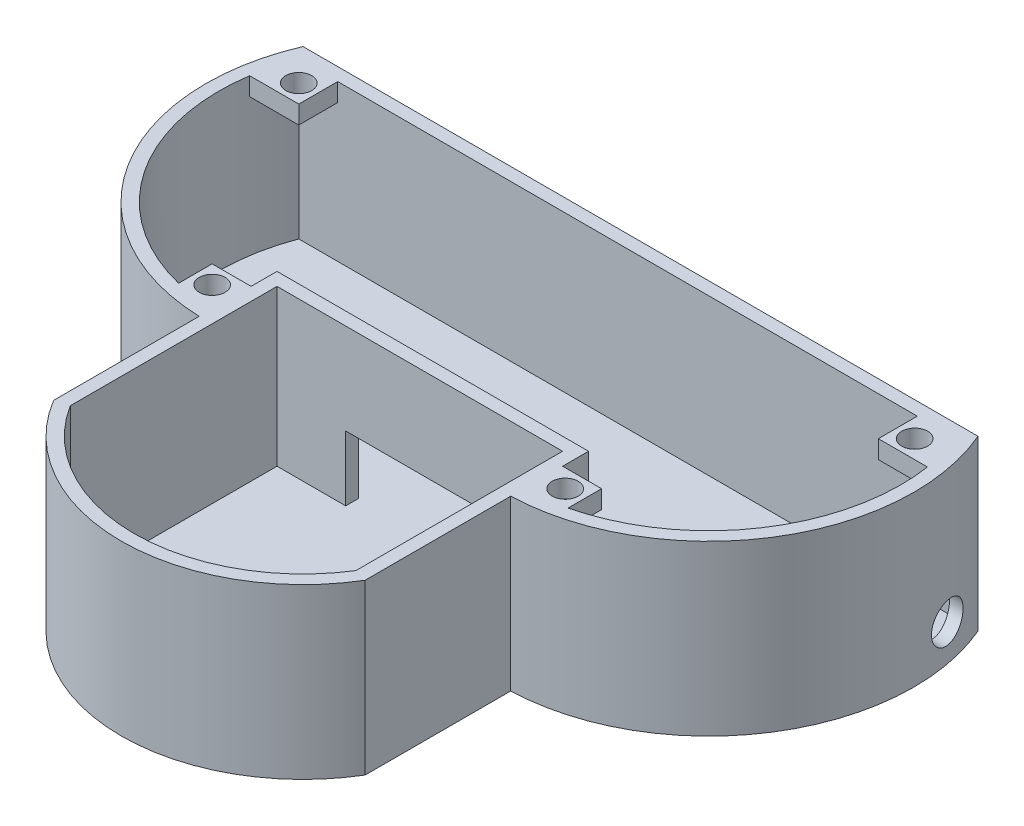
from build123d import *

# Parameters (mm, degrees)
SALIENTE_EXTRUIR1_DEPTH    = 65
VACIADO1_T                 = -5
SALIENTE_EXTRUIR2_DEPTH    = 60
CROQUIS4_W                 = 60.454390592
CROQUIS4_H                 = 25
CORTAR_EXTRUIR1_DEPTH      = 65
CORTAR_EXTRUIR2_DEPTH      = 65
CORTAR_EXTRUIR2_DEPTH_BACK = 75
CROQUIS5_R                 = 7.5
SALIENTE_EXTRUIR3_START    = -7
SALIENTE_EXTRUIR3_DEPTH    = 7
SALIENTE_EXTRUIR5_START    = -7
SALIENTE_EXTRUIR5_DEPTH    = 7
SALIENTE_EXTRUIR7_START    = -7
SALIENTE_EXTRUIR7_DEPTH    = 7
SALIENTE_EXTRUIR8_START    = -7
SALIENTE_EXTRUIR8_DEPTH    = 7
CROQUIS12_R                = 5
CORTAR_EXTRUIR3_DEPTH      = 8


with BuildPart() as part:
    # Croquis2 → Saliente-Extruir1 (new body)
    with BuildSketch(Plane(origin=(0, 0, 0), x_dir=(1, 0, 0), z_dir=(0, 1, 0))):
        with BuildLine():
            ThreePointArc((60, -55), (124.004556318, -18.45744493), (130, 55))
            Line((130, 55), (-130, 55))
            ThreePointArc((-130, 55), (-124.004556318, -18.45744493), (-60, -55))
            Line((-60, -55), (-60, -111.06))
            ThreePointArc((-60, -111.06), (0, -145.004487245), (60, -111.06))
            Line((60, -111.06), (60, -55))
        make_face()
    extrude(amount=SALIENTE_EXTRUIR1_DEPTH)

    # Vaciado1
    vaciado1_openings = [part.faces().sort_by_distance(p)[0] for p in [
        (0, 65, 22.416037692),
    ]]
    offset(amount=VACIADO1_T, openings=vaciado1_openings, kind=Kind.INTERSECTION)

    # Croquis3 → Saliente-Extruir2 (add)
    with BuildSketch(Plane(origin=(0, 5, 0), x_dir=(1, 0, 0), z_dir=(0, 1, 0))):
        with BuildLine():
            ThreePointArc((-60, -49.997006185), (-57.500082648, -50.044139409), (-55, -50.006788897))
            Line((-55, -50.006788897), (-55, -30.006788897))
            Line((-55, -30.006788897), (55, -30.006788897))
            Line((55, -30.006788897), (55, -50.006788897))
            ThreePointArc((55, -50.006788897), (57.500082648, -50.044139409), (60, -49.997006185))
            Line((60, -49.997006185), (60, -25.006788897))
            Line((60, -25.006788897), (-60, -25.006788897))
            Line((-60, -25.006788897), (-60, -49.997006185))
        make_face()
    extrude(amount=SALIENTE_EXTRUIR2_DEPTH)

    # Croquis4 → Cortar-Extruir1 (cut)
    with BuildSketch(Plane.XY.offset(30.006788897)):
        with Locations((1.676963708, 17.5)):
            Rectangle(CROQUIS4_W, CROQUIS4_H)
    extrude(amount=-CORTAR_EXTRUIR1_DEPTH, mode=Mode.SUBTRACT)

    # Croquis5 → Cortar-Extruir2 (cut, two sides: drawn at the far end of the back side and taken through both)
    with BuildSketch(Plane(origin=(130, 0, 0), x_dir=(0, 0, -1), z_dir=(1, 0, 0)).offset(-CORTAR_EXTRUIR2_DEPTH_BACK)):
        with Locations(Location((38.54320604, 13.712018928, 0), (0, 0, 180))):
            Circle(CROQUIS5_R)
    extrude(amount=CORTAR_EXTRUIR2_DEPTH + CORTAR_EXTRUIR2_DEPTH_BACK, mode=Mode.SUBTRACT)

    # Croquis6 → Saliente-Extruir3 (add)
    with BuildSketch(Plane(origin=(0, 65, 0), x_dir=(1, 0, 0), z_dir=(0, 1, 0)).offset(SALIENTE_EXTRUIR3_START)):
        with BuildLine():
            Line((-126.620697254, 50), (-111.620697254, 50))
            Line((-111.620697254, 50), (-111.620697254, 35))
            Line((-111.620697254, 35), (-130.526494323, 35))
            ThreePointArc((-130.526494323, 35), (-128.967419464, 42.602546357), (-126.620697254, 50))
        make_face()
    extrude(amount=SALIENTE_EXTRUIR3_DEPTH)

    # Croquis8 → Saliente-Extruir5 (add)
    with BuildSketch(Plane(origin=(0, 65, 0), x_dir=(1, 0, 0), z_dir=(0, 1, 0)).offset(SALIENTE_EXTRUIR5_START)):
        with BuildLine():
            Line((126.620697254, 50), (111.620697254, 50))
            Line((111.620697254, 50), (111.620697254, 35))
            Line((111.620697254, 35), (130.526494323, 35))
            ThreePointArc((130.526494323, 35), (128.967419464, 42.602546357), (126.620697254, 50))
        make_face()
    extrude(amount=SALIENTE_EXTRUIR5_DEPTH)

    # Croquis10 → Saliente-Extruir7 (add)
    with BuildSketch(Plane(origin=(0, 65, 0), x_dir=(1, 0, 0), z_dir=(0, 1, 0)).offset(SALIENTE_EXTRUIR7_START)):
        with BuildLine():
            Line((-60, -49.997006185), (-60, -34.997006185))
            Line((-60, -34.997006185), (-75, -34.997006185))
            Line((-75, -34.997006185), (-75, -47.909881434))
            ThreePointArc((-75, -47.909881434), (-67.5535332, -49.338182668), (-60, -49.997006185))
        make_face()
    extrude(amount=SALIENTE_EXTRUIR7_DEPTH)

    # Croquis11 → Saliente-Extruir8 (add)
    with BuildSketch(Plane(origin=(0, 65, 0), x_dir=(1, 0, 0), z_dir=(0, 1, 0)).offset(SALIENTE_EXTRUIR8_START)):
        with BuildLine():
            Line((60, -49.997006185), (60, -34.997006185))
            Line((60, -34.997006185), (75, -34.997006185))
            Line((75, -34.997006185), (75, -47.909881434))
            ThreePointArc((75, -47.909881434), (67.5535332, -49.338182668), (60, -49.997006185))
        make_face()
    extrude(amount=SALIENTE_EXTRUIR8_DEPTH)

    # Croquis12 → Cortar-Extruir3 (cut)
    with BuildSketch(Plane(origin=(0, 65, 0), x_dir=(1, 0, 0), z_dir=(0, 1, 0))):
        with Locations(Location((-68, -41.997006185, 0), (0, 0, 270))):
            Circle(CROQUIS12_R)
        with Locations(Location((-118.620697254, 42, 0), (0, 0, 270))):
            Circle(CROQUIS12_R)
        with Locations(Location((118.620697254, 42, 0), (0, 0, 270))):
            Circle(CROQUIS12_R)
        with Locations(Location((68, -41.997006185, 0), (0, 0, 270))):
            Circle(CROQUIS12_R)
    extrude(amount=-CORTAR_EXTRUIR3_DEPTH, mode=Mode.SUBTRACT)


solid = part.part
